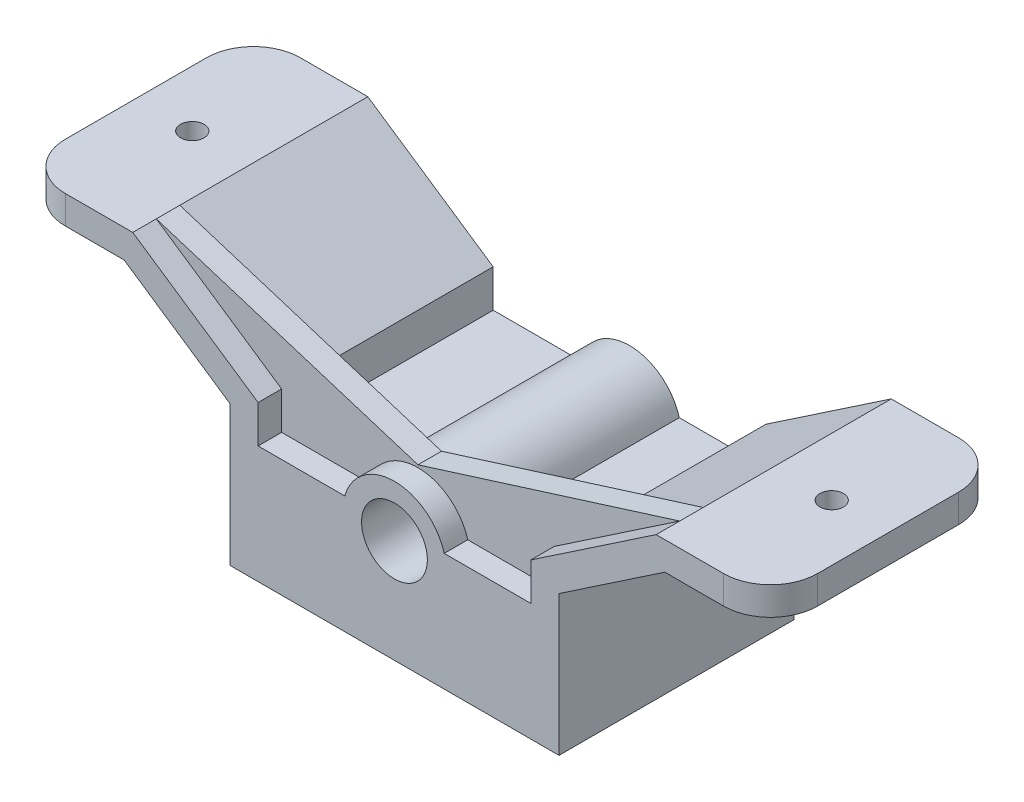
from build123d import *

# Parameters (mm, degrees)
BOSS_EXTRUDE1_DEPTH = 25
BOSS_EXTRUDE3_START = -5
BOSS_EXTRUDE3_DEPTH = 5
HOLE1_D             = 14
HOLE2_D             = 5
FILLET1_R           = 10


with BuildPart() as part:
    # Sketch1 → Boss-Extrude1 (new, symmetric)
    with BuildSketch(Plane.XY):
        with BuildLine():
            Line((-35, 0), (-35, 29.811196065))
            Line((-35, 29.811196065), (-57.5, 45))
            Line((-57.5, 45), (-80, 45))
            Line((-80, 45), (-80, 51))
            Line((-80, 51), (-55.664377376, 51))
            Line((-55.664377376, 51), (-29, 33))
            Line((-29, 33), (-29, 25))
            Line((-29, 25), (-10.583005244, 25))
            ThreePointArc((-10.583005244, 25), (0, 33), (10.583005244, 25))
            Line((10.583005244, 25), (29, 25))
            Line((29, 25), (29, 33))
            Line((29, 33), (55.664377376, 51))
            Line((55.664377376, 51), (80, 51))
            Line((80, 51), (80, 45))
            Line((80, 45), (57.5, 45))
            Line((57.5, 45), (35, 29.811196065))
            Line((35, 29.811196065), (35, 0))
            Line((35, 0), (-35, 0))
        make_face()
    extrude(amount=BOSS_EXTRUDE1_DEPTH, both=True)

    # Sketch2 → Boss-Extrude3 (add)
    with BuildSketch(Plane.XY.offset(25).offset(BOSS_EXTRUDE3_START)):
        with BuildLine():
            Line((55.664377376, 51), (29, 33))
            Line((29, 33), (29, 25))
            Line((29, 25), (10.583005244, 25))
            ThreePointArc((10.583005244, 25), (0, 33), (-10.583005244, 25))
            Line((-10.583005244, 25), (-29, 25))
            Line((-29, 25), (-29, 33))
            Line((-29, 33), (-55.664377376, 51))
            Line((-55.664377376, 51), (0, 33.529077086))
            Line((0, 33.529077086), (55.664377376, 51))
        make_face()
    extrude(amount=-BOSS_EXTRUDE3_DEPTH)

    # Hole1 (through all)
    with Locations(Plane.XY.offset(25)):
        with Locations((0, 22)):
            Hole(HOLE1_D / 2)

    # Hole2 (through all)
    with Locations(Plane(origin=(0, 51, 0), x_dir=(1, 0, 0), z_dir=(0, 1, 0))):
        with Locations((68, 0)):
            hole2 = Hole(HOLE2_D / 2)

    # Mirror1: Hole2 across plane
    add(hole2.mirror(Plane(origin=(0, 0, 0), x_dir=(0, 0, 1), z_dir=(1, 0, 0))), mode=Mode.SUBTRACT)

    # Fillet1
    fillet1_edges = [part.edges().sort_by_distance(p)[0] for p in [
        (-80, 48, -25),
        (80, 48, 25),
        (80, 48, -25),
        (-80, 48, 25),
    ]]
    fillet(fillet1_edges, radius=FILLET1_R)


solid = part.part
